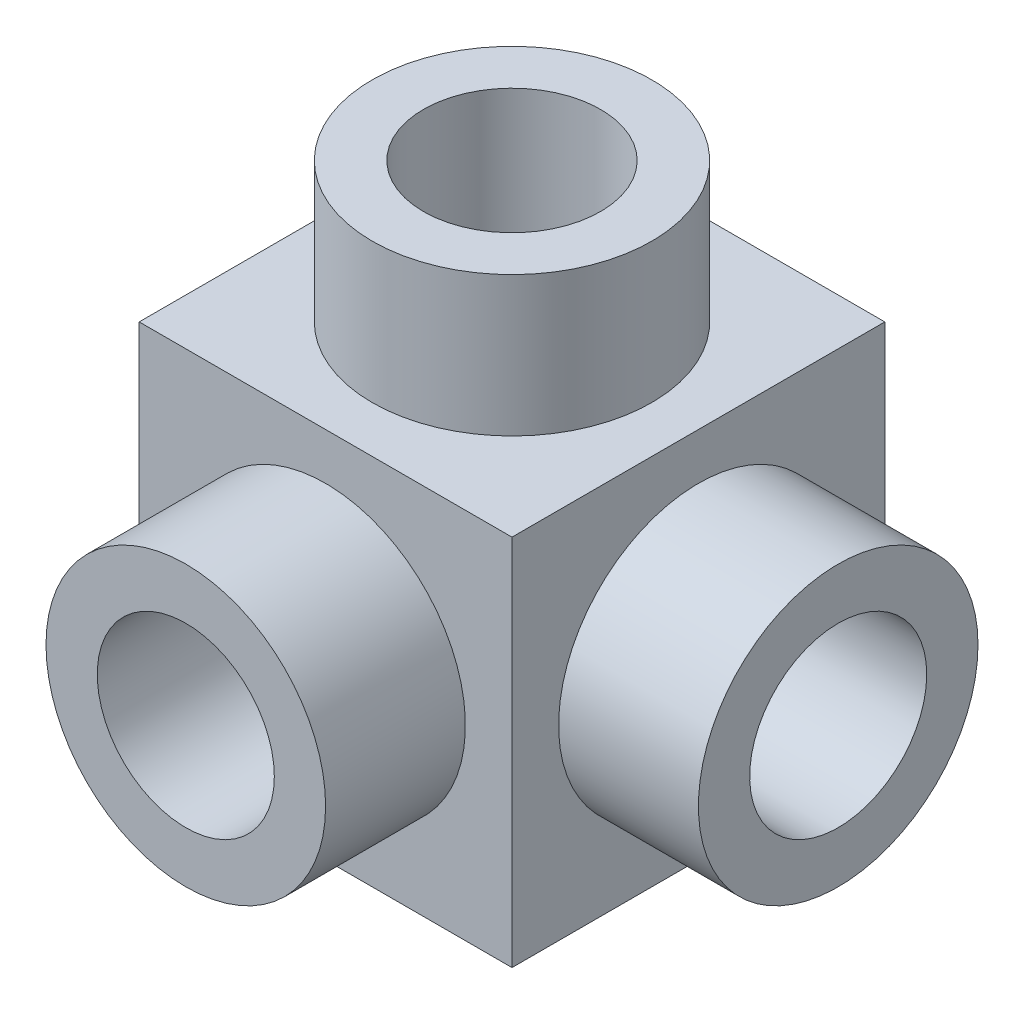
from build123d import *

# Parameters (mm, degrees)
CROQUIS1_R              = 30
CROQUIS1_R_2            = 19
SALIENTE_EXTRUIR1_DEPTH = 30
CROQUIS2_W              = 80
CROQUIS2_H              = 80
SALIENTE_EXTRUIR2_DEPTH = 80
CROQUIS3_R              = 30
CROQUIS3_R_2            = 19
SALIENTE_EXTRUIR3_DEPTH = 30
CROQUIS4_R              = 30
CROQUIS4_R_2            = 19
SALIENTE_EXTRUIR4_DEPTH = 30


with BuildPart() as part:
    # Croquis1 → Saliente-Extruir1 (new body)
    with BuildSketch(Plane.XY):
        Circle(CROQUIS1_R)
        Circle(CROQUIS1_R_2, mode=Mode.SUBTRACT)
    extrude(amount=SALIENTE_EXTRUIR1_DEPTH)

    # Croquis2 → Saliente-Extruir2 (add)
    with BuildSketch(Plane.XY):
        Rectangle(CROQUIS2_W, CROQUIS2_H)
    extrude(amount=-SALIENTE_EXTRUIR2_DEPTH)

    # Croquis3 → Saliente-Extruir3 (add)
    with BuildSketch(Plane(origin=(40, 0, 0), x_dir=(0, 0, -1), z_dir=(1, 0, 0))):
        with Locations((40, 0)):
            Circle(CROQUIS3_R)
        with Locations(Location((40, 0, 0), (0, 0, 90))):
            Circle(CROQUIS3_R_2, mode=Mode.SUBTRACT)
    extrude(amount=SALIENTE_EXTRUIR3_DEPTH)

    # Croquis4 → Saliente-Extruir4 (add)
    with BuildSketch(Plane(origin=(0, 40, 0), x_dir=(1, 0, 0), z_dir=(0, 1, 0))):
        with Locations(Location((0, 40, 0), (0, 0, 270))):
            Circle(CROQUIS4_R)
        with Locations(Location((0, 40, 0), (0, 0, 270))):
            Circle(CROQUIS4_R_2, mode=Mode.SUBTRACT)
    extrude(amount=SALIENTE_EXTRUIR4_DEPTH)


solid = part.part
